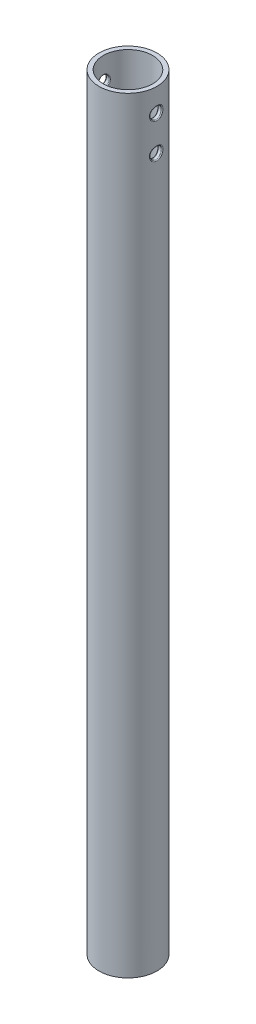
from build123d import *

# Parameters (mm, degrees)
SKETCH1_R               = 5
SKETCH1_R_2             = 4.25
BOSS_EXTRUDE1_DEPTH     = 132.21
CUT_EXTRUDE1_DEPTH      = 133.398958077
CUT_EXTRUDE1_DEPTH_BACK = 133.398958077
SKETCH2_R               = 1
FILLET1_R               = 0.15


with BuildPart() as part:
    # Sketch1 → Boss-Extrude1 (new body)
    with BuildSketch(Plane(origin=(0, 0, 0), x_dir=(1, 0, 0), z_dir=(0, 1, 0))):
        with Locations(Location((0, 0, 0), (0, 0, 270))):
            Circle(SKETCH1_R)
        with Locations(Location((0, 0, 0), (0, 0, 270))):
            Circle(SKETCH1_R_2, mode=Mode.SUBTRACT)
    extrude(amount=BOSS_EXTRUDE1_DEPTH)

    # Sketch2 → Cut-Extrude1 (cut, two sides: drawn at the far end of the back side and taken through both)
    with BuildSketch(Plane(origin=(0, 0, 0), x_dir=(0, 0, -1), z_dir=(1, 0, 0)).offset(-CUT_EXTRUDE1_DEPTH_BACK)):
        with Locations((0, 128.21)):
            Circle(SKETCH2_R)
        with Locations((0, 122.21)):
            Circle(SKETCH2_R)
    extrude(amount=CUT_EXTRUDE1_DEPTH + CUT_EXTRUDE1_DEPTH_BACK, mode=Mode.SUBTRACT)

    # Fillet1
    fillet1_edges = [part.edges().sort_by_distance(p)[0] for p in [
        (-4.898979486, 128.21, 1),
        (4.898979486, 128.21, 1),
        (4.130677916, 128.209999999, 0.999999995),
        (-4.130677916, 128.209999999, 0.999999995),
        (-4.898979486, 122.21, 1),
        (4.898979486, 122.21, 1),
        (4.130677916, 122.209999999, 0.999999995),
        (-4.130677916, 122.209999999, 0.999999995),
    ]]
    fillet(fillet1_edges, radius=FILLET1_R)


solid = part.part
